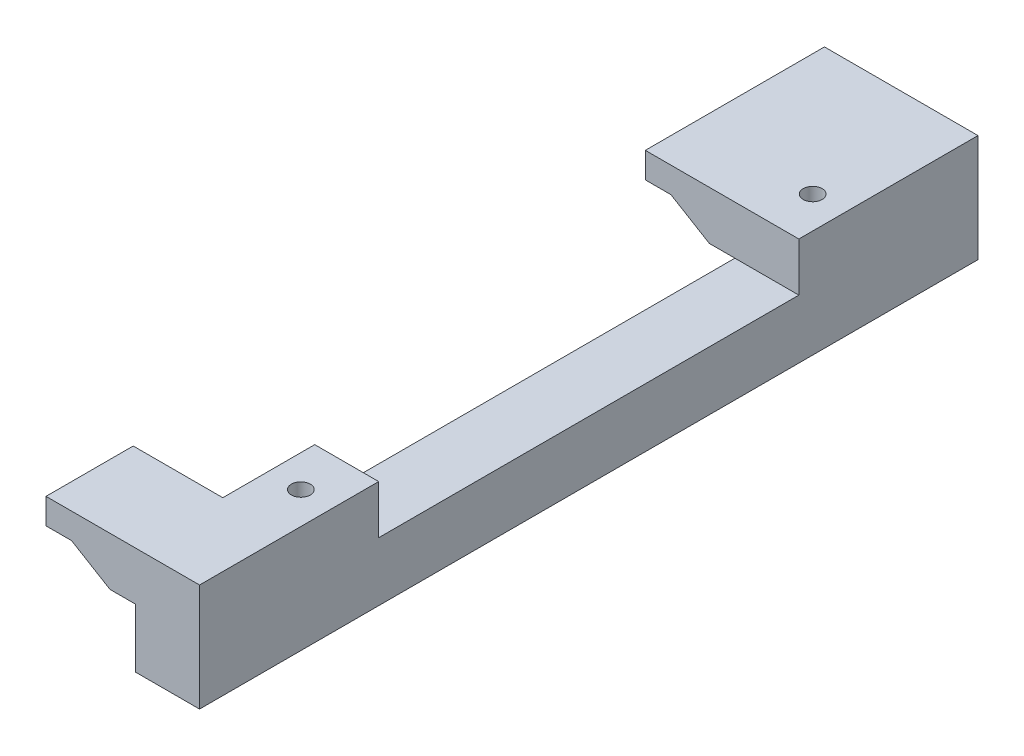
from build123d import *

# Parameters (mm, degrees)
SKETCH1_W                           = 225.24
SKETCH1_H                           = 278.07
BOSS_EXTRUDE1_DEPTH                 = 10
SKETCH4_W                           = 30
SKETCH4_H                           = 21
BOSS_EXTRUDE3_DEPTH                 = 152.09
CUT_EXTRUDE2_DEPTH                  = 152.09
BOSS_EXTRUDE5_DEPTH                 = 1.5
CUT_EXTRUDE3_DEPTH                  = 1.75
SKETCH10_W                          = 225.24
SKETCH10_H                          = 10
CUT_EXTRUDE4_DEPTH                  = 302.607674471
SKETCH12_W                          = 1.85
SKETCH12_H                          = 21.001
F_3_7_3_7_DIAMETER_HOLE1_AT_2_COUNT = 2
F_3_7_3_7_DIAMETER_HOLE1_AT_2_PITCH = 100
SKETCH13_W                          = 82.09
SKETCH13_H                          = 9.5
CUT_EXTRUDE5_DEPTH                  = 146.573799926
SKETCH14_W                          = 17.96
SKETCH14_H                          = 9.5
CUT_EXTRUDE6_DEPTH                  = 17.5


with BuildPart() as part:
    # Sketch1 → Boss-Extrude1 (new body)
    with BuildSketch(Plane(origin=(0, 0, 0), x_dir=(1, 0, 0), z_dir=(0, 1, 0))):
        Rectangle(SKETCH1_W, SKETCH1_H)
    extrude(amount=BOSS_EXTRUDE1_DEPTH)

    # Sketch10 → Cut-Extrude4 (cut, through all)
    with BuildSketch(Plane.XY.offset(139.035)):
        with Locations((0, 5)):
            Rectangle(SKETCH10_W, SKETCH10_H)
    extrude(amount=-CUT_EXTRUDE4_DEPTH, mode=Mode.SUBTRACT)


with BuildPart() as body_2:
    # Sketch4 → Boss-Extrude3 (new body)
    with BuildSketch(Plane.XY.offset(139.035)):
        with Locations((-23.63, 20.5)):
            Rectangle(SKETCH4_W, SKETCH4_H)
    extrude(amount=-BOSS_EXTRUDE3_DEPTH)

    # Sketch5 → Cut-Extrude2 (cut)
    with BuildSketch(Plane.XY.offset(139.035)):
        Polygon((-38.63, 10), (-21.13, 10), (-21.13, 21.5), (-26.13, 21.5), (-33.63, 26), (-38.63, 26), align=None)
    extrude(amount=-CUT_EXTRUDE2_DEPTH, mode=Mode.SUBTRACT)

    # Sketch8 → Cut-Extrude3 (cut, symmetric)
    with BuildSketch(Plane(origin=(0, 17.25, 0), x_dir=(1, 0, 0), z_dir=(0, 1, 0))):
        with BuildLine():
            Line((-21.13, -7.817281323), (-21.13, -2.072718677))
            ThreePointArc((-21.13, -2.072718677), (-19.63, -4.945), (-21.13, -7.817281323))
        make_face()
    extrude(amount=CUT_EXTRUDE3_DEPTH, both=True, mode=Mode.SUBTRACT)

    # Sketch12 → Ø3.7 (3.7) Diameter Hole1 (revolve, cut)
    with BuildSketch(Plane(origin=(-14.88, 31, 12.99), x_dir=(0, 0, 1), z_dir=(1, 0, 0))):
        with Locations((0.925, 10.5005)):
            Rectangle(SKETCH12_W, SKETCH12_H)
    f_3_7_3_7_diameter_hole1 = revolve(axis=Axis((-14.88, 37.35, 12.99), (0, -1, 0)), mode=Mode.SUBTRACT)

    # Ø3.7 (3.7) Diameter Hole1 at 2: Ø3.7 (3.7) Diameter Hole1 ×2
    with Locations(*[(0, 0, i * F_3_7_3_7_DIAMETER_HOLE1_AT_2_PITCH) for i in range(1, F_3_7_3_7_DIAMETER_HOLE1_AT_2_COUNT)]):
        add(f_3_7_3_7_diameter_hole1, mode=Mode.SUBTRACT)

    # Sketch13 → Cut-Extrude5 (cut, through all)
    with BuildSketch(Plane(origin=(-8.63, 0, 0), x_dir=(0, 0, -1), z_dir=(1, 0, 0))):
        with Locations((-62.99, 26.25)):
            Rectangle(SKETCH13_W, SKETCH13_H)
    extrude(amount=-CUT_EXTRUDE5_DEPTH, mode=Mode.SUBTRACT)

    # Sketch14 → Cut-Extrude6 (cut)
    with BuildSketch(Plane.ZY.offset(38.63)):
        with Locations((113.015, 26.25)):
            Rectangle(SKETCH14_W, SKETCH14_H)
    extrude(amount=-CUT_EXTRUDE6_DEPTH, mode=Mode.SUBTRACT)


with BuildPart() as body_3:
    # Sketch7 → Boss-Extrude5 (new, symmetric)
    with BuildSketch(Plane(origin=(0, 17.25, 0), x_dir=(1, 0, 0), z_dir=(0, 1, 0))):
        with BuildLine():
            Line((-21.13, -131.907281323), (-21.13, -126.162718677))
            ThreePointArc((-21.13, -126.162718677), (-22.63, -129.035), (-21.13, -131.907281323))
        make_face()
    extrude(amount=BOSS_EXTRUDE5_DEPTH, both=True)


solid = Compound([body_2.part, body_3.part])
